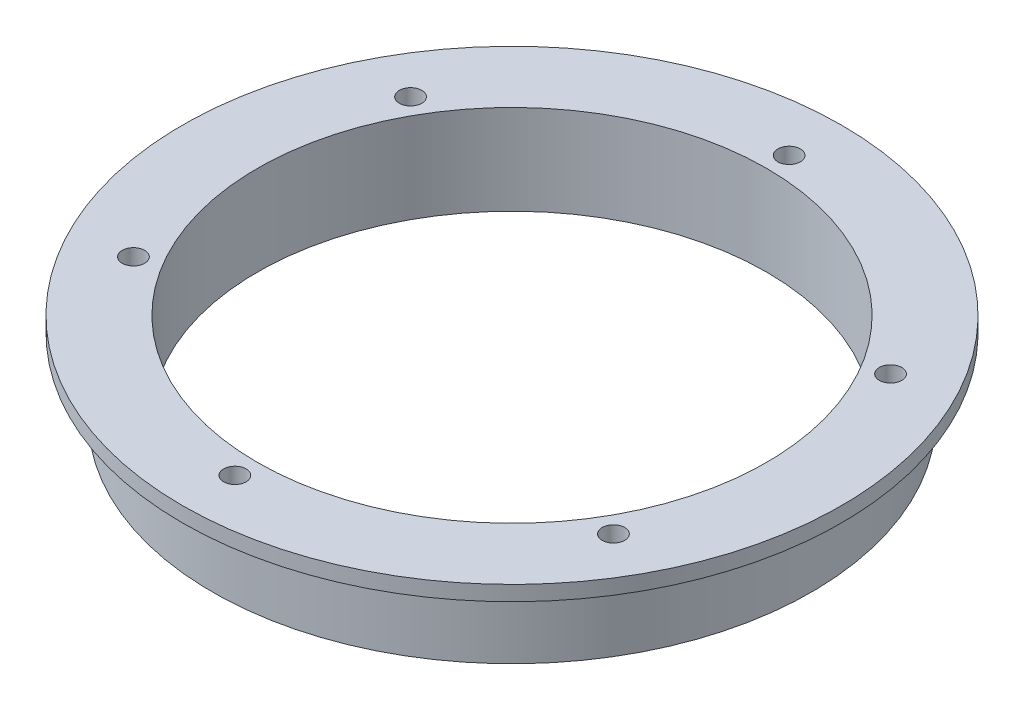
from build123d import *

# Parameters (mm, degrees)
SKETCH_4_R          = 1.5
CUT_EXTRUDE_1_DEPTH = 64.371918071


with BuildPart() as part:
    # 草图2 → 旋转1 (revolve)
    with BuildSketch(Plane.XY, mode=Mode.PRIVATE) as revolve_1_sk:
        Polygon((34, 12), (34, 0), (40, 0), (40, 10), (44, 10), (44, 12), align=None)
    revolve(revolve_1_sk.sketch.rotate(Axis((0, 0, 0), (0, 1, 0)), 90), axis=Axis((0, 0, 0), (0, 1, 0)))

    # 草图4 → 切除-拉伸1 (cut, through all)
    with BuildSketch(Plane(origin=(0, 0, 0), x_dir=(1, 0, 0), z_dir=(0, 1, 0))):
        with Locations(Location((0, 37, 0), (0, 0, 270))):
            Circle(SKETCH_4_R)
        with Locations(Location((32.04293994, 18.5, 0), (0, 0, 270))):
            Circle(SKETCH_4_R)
        with Locations(Location((32.04293994, -18.5, 0), (0, 0, 270))):
            Circle(SKETCH_4_R)
        with Locations(Location((0, -37, 0), (0, 0, 270))):
            Circle(SKETCH_4_R)
        with Locations(Location((-32.04293994, -18.5, 0), (0, 0, 270))):
            Circle(SKETCH_4_R)
        with Locations(Location((-32.04293994, 18.5, 0), (0, 0, 270))):
            Circle(SKETCH_4_R)
    extrude(amount=CUT_EXTRUDE_1_DEPTH, mode=Mode.SUBTRACT)


solid = part.part
